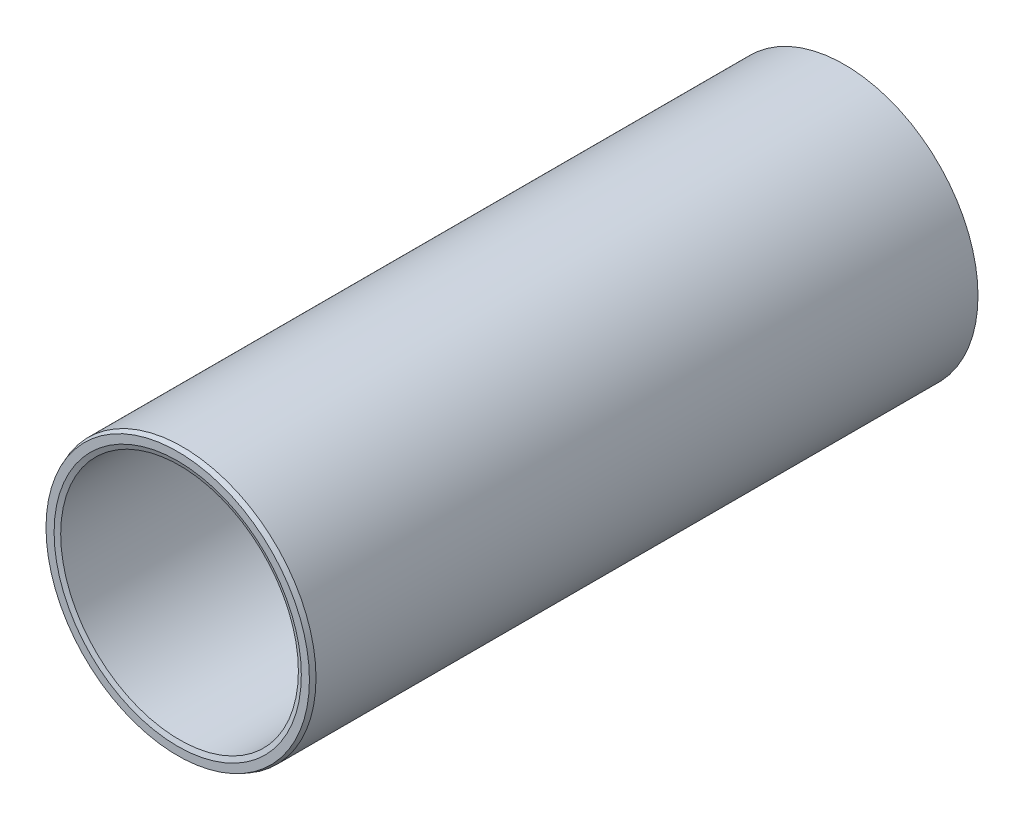
from build123d import *
from OCP.BRepFilletAPI import BRepFilletAPI_MakeChamfer

# Parameters (mm, degrees)
CROQUIS1_R              = 1.1235
CROQUIS1_R_2            = 1
SALIENTE_EXTRUIR1_DEPTH = 5.625
CHAFL_N1_SIZE           = 0.04
CHAFL_N1_SIZE2          = 0.015354561


with BuildPart() as part:
    # Croquis1 → Saliente-Extruir1 (new body)
    with BuildSketch(Plane.XY):
        with Locations(Location((0, 0, 0), (0, 0, 180))):
            Circle(CROQUIS1_R)
        with Locations(Location((0, 0, 0), (0, 0, 180))):
            Circle(CROQUIS1_R_2, mode=Mode.SUBTRACT)
    extrude(amount=SALIENTE_EXTRUIR1_DEPTH)

    # Chaflán1: one chamfer whose edges measure the first distance from different faces: ONE call of the kernel's chamfer builder (chamfer() names one face for all edges)
    chafl_n1_edges_1 = [part.edges().sort_by_distance(p)[0] for p in [
        (1.1235, 0, 0),
    ]]
    chafl_n1_side_1 = [part.faces().sort_by_distance(p)[0] for p in [
        (1.091722621, 0, 0),
    ]]
    chafl_n1_edges_2 = [part.edges().sort_by_distance(p)[0] for p in [
        (1.1235, 0, 5.625),
    ]]
    chafl_n1_side_2 = [part.faces().sort_by_distance(p)[0] for p in [
        (1.1235, 0, 2.8125),
    ]]
    chafl_n1_edges_3 = [part.edges().sort_by_distance(p)[0] for p in [
        (1, 0, 0),
    ]]
    chafl_n1_side_3 = [part.faces().sort_by_distance(p)[0] for p in [
        (1, 0, 2.8125),
    ]]
    chafl_n1_edges_4 = [part.edges().sort_by_distance(p)[0] for p in [
        (1, 0, 5.625),
    ]]
    chafl_n1_side_4 = [part.faces().sort_by_distance(p)[0] for p in [
        (1.091722621, 0, 5.625),
    ]]
    chafl_n1 = BRepFilletAPI_MakeChamfer(part.part.solid().wrapped)
    for e in chafl_n1_edges_1:
        chafl_n1.Add(CHAFL_N1_SIZE, CHAFL_N1_SIZE2, e.wrapped, chafl_n1_side_1[0].wrapped)  # the first distance lies on this face
    for e in chafl_n1_edges_2:
        chafl_n1.Add(CHAFL_N1_SIZE, CHAFL_N1_SIZE2, e.wrapped, chafl_n1_side_2[0].wrapped)  # the first distance lies on this face
    for e in chafl_n1_edges_3:
        chafl_n1.Add(CHAFL_N1_SIZE, CHAFL_N1_SIZE2, e.wrapped, chafl_n1_side_3[0].wrapped)  # the first distance lies on this face
    for e in chafl_n1_edges_4:
        chafl_n1.Add(CHAFL_N1_SIZE, CHAFL_N1_SIZE2, e.wrapped, chafl_n1_side_4[0].wrapped)  # the first distance lies on this face
    add(Compound.cast(chafl_n1.Shape()), mode=Mode.REPLACE)


solid = part.part
